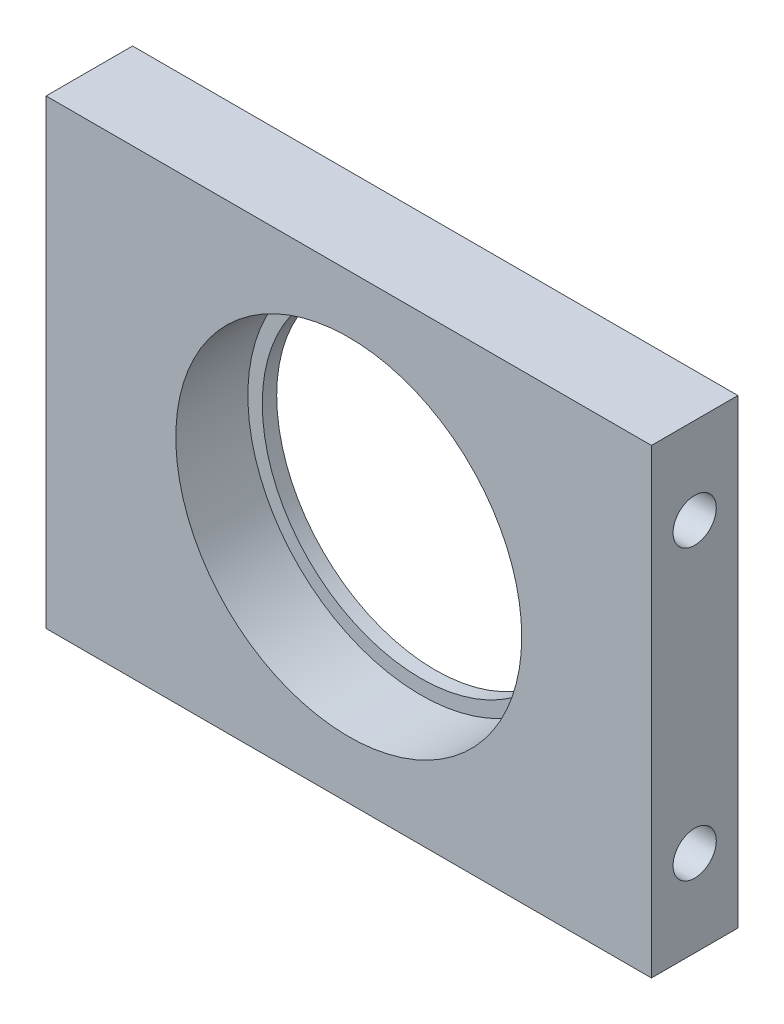
from build123d import *

# Parameters (mm, degrees)
SKETCH_1_W                = 42
SKETCH_1_H                = 32
EXTRUDE_1_DEPTH           = 6
HOLE_WIZARD_3_0_3_1_D     = 3
HOLE_WIZARD_3_0_3_1_DEPTH = 6
HOLE_WIZARD_3_0_3_2_D     = 3
HOLE_WIZARD_3_0_3_2_DEPTH = 6
M24X2_0_1_D               = 22
M24X2_0_1_CBORE_D         = 24
M24X2_0_1_CBORE_DEPTH     = 4
SKETCH_8_R                = 12
CUT_EXTRUDE_1_DEPTH       = 5


with BuildPart() as part:
    # 草图1 → 凸台-拉伸1 (new body)
    with BuildSketch(Plane.XY.offset(6)):
        Rectangle(SKETCH_1_W, SKETCH_1_H)
    extrude(amount=-EXTRUDE_1_DEPTH)

    # Ø3.0 (3) 直径孔1
    with Locations(Plane(origin=(21, 0, 0), x_dir=(0, 0, -1), z_dir=(1, 0, 0))):
        with Locations((-3, -10), (-3, 10)):
            Hole(HOLE_WIZARD_3_0_3_1_D / 2, depth=HOLE_WIZARD_3_0_3_1_DEPTH)

    # Ø3.0 (3) 直径孔2
    with Locations(Plane.ZY.offset(21)):
        with Locations((3, -10), (3, 10)):
            Hole(HOLE_WIZARD_3_0_3_2_D / 2, depth=HOLE_WIZARD_3_0_3_2_DEPTH)

    # M24x2.0 螺纹孔1 (through all)
    with Locations(Plane.XY.offset(6)):
        with Locations((0, 0)):
            CounterBoreHole(M24X2_0_1_D / 2, M24X2_0_1_CBORE_D / 2, M24X2_0_1_CBORE_DEPTH)

    # 草图8 → 切除-拉伸1 (cut)
    with BuildSketch(Plane.XY.offset(6)):
        Circle(SKETCH_8_R)
    extrude(amount=-CUT_EXTRUDE_1_DEPTH, mode=Mode.SUBTRACT)


solid = part.part
